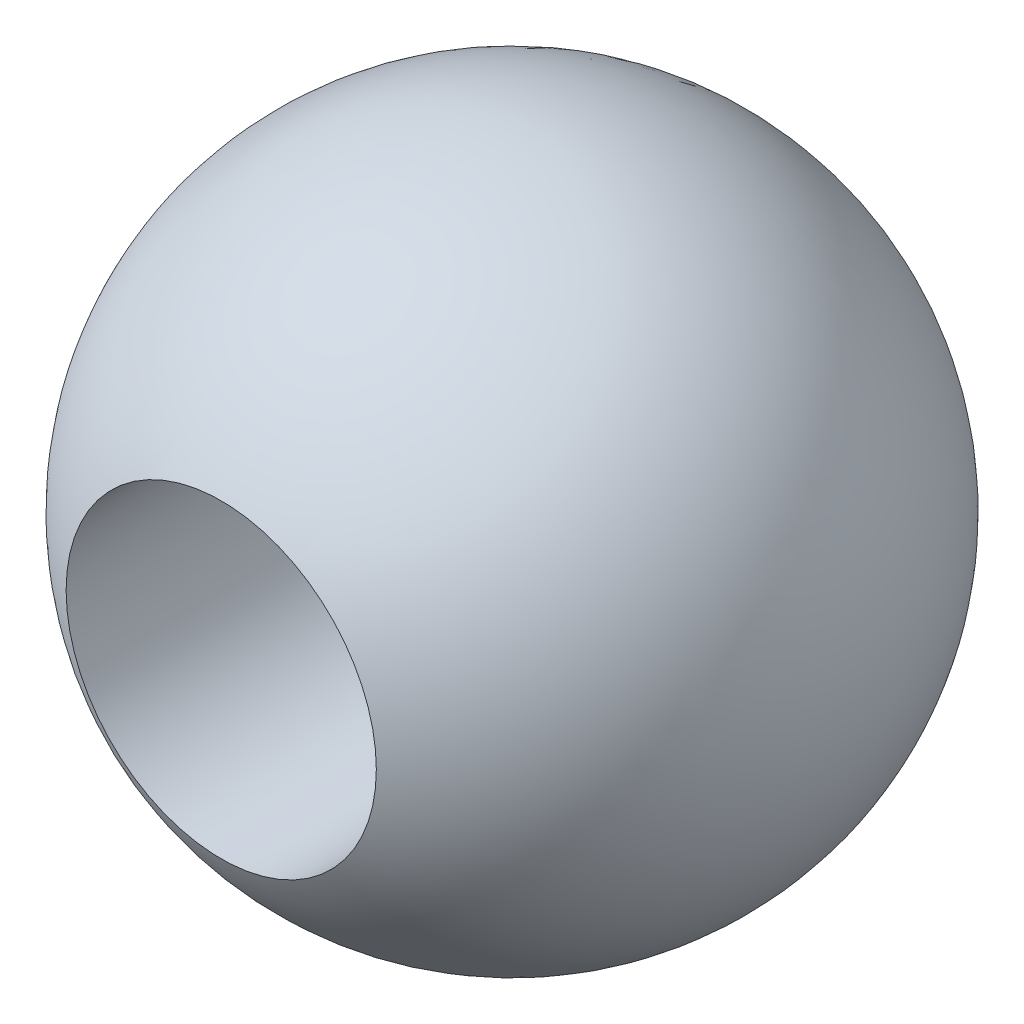
from build123d import *

# Parameters (mm, degrees)
CUT_EXTRUDE1_DEPTH      = 15.722431864
CUT_EXTRUDE1_DEPTH_BACK = 15.722431864
SKETCH2_R               = 4
SKETCH3_R               = 1.3
CUT_EXTRUDE2_DEPTH      = 15.722431864


with BuildPart() as part:
    # Sketch1 → Revolve1 (revolve)
    with BuildSketch(Plane.XY):
        with BuildLine():
            Line((-8.5, 0), (8.5, 0))
            ThreePointArc((8.5, 0), (0, 8.5), (-8.5, 0))
        make_face()
    revolve(axis=Axis((-8.5, 0, 0), (1, 0, 0)))

    # Sketch2 → Cut-Extrude1 (cut, two sides: drawn at the far end of the back side and taken through both)
    with BuildSketch(Plane.XY.offset(-CUT_EXTRUDE1_DEPTH_BACK)):
        with Locations(Location((0, 0, 0), (0, 0, 180))):
            Circle(SKETCH2_R)
    extrude(amount=CUT_EXTRUDE1_DEPTH + CUT_EXTRUDE1_DEPTH_BACK, mode=Mode.SUBTRACT)

    # Sketch3 → Cut-Extrude2 (cut, through all)
    with BuildSketch(Plane(origin=(0, 0, 0), x_dir=(1, 0, 0), z_dir=(0, 1, 0))):
        with Locations(Location((0, 0, 0), (0, 0, 270))):
            Circle(SKETCH3_R)
    extrude(amount=-CUT_EXTRUDE2_DEPTH, mode=Mode.SUBTRACT)


solid = part.part
